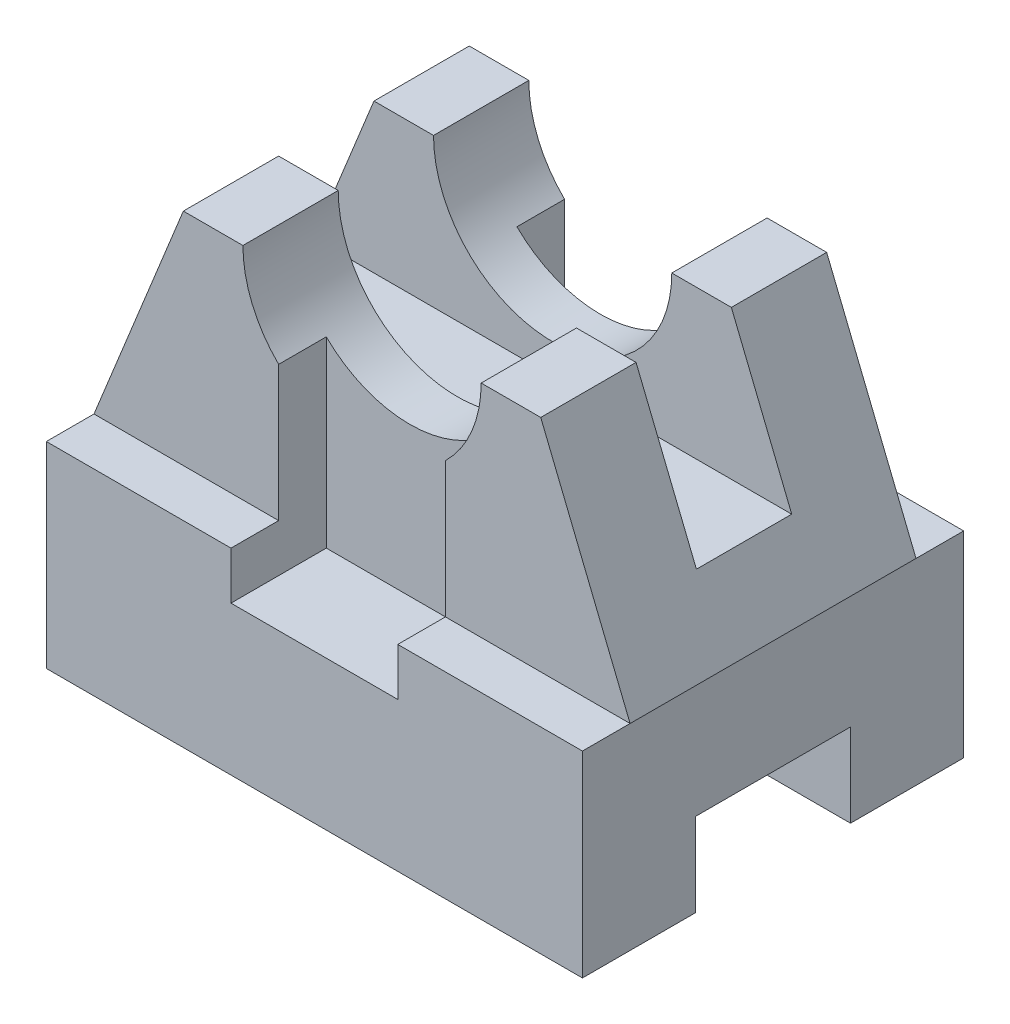
from build123d import *

# Parameters (mm, degrees)
SKETCH1_W                = 90
SKETCH1_H                = 64
BOSS_EXTRUDE1_DEPTH      = 33
BOSS_EXTRUDE2_DEPTH      = 24
BOSS_EXTRUDE2_DEPTH_BACK = 24
SKETCH3_W                = 90
SKETCH3_H                = 16
CUT_EXTRUDE1_DEPTH       = 25
SKETCH4_W                = 28
SKETCH4_H                = 16
CUT_EXTRUDE2_DEPTH       = 45
SKETCH6_W                = 90
SKETCH6_H                = 26
CUT_EXTRUDE3_DEPTH       = 14


with BuildPart() as part:
    # Sketch1 → Boss-Extrude1 (new body)
    with BuildSketch(Plane(origin=(0, 0, 0), x_dir=(1, 0, 0), z_dir=(0, 1, 0))):
        Rectangle(SKETCH1_W, SKETCH1_H)
    extrude(amount=BOSS_EXTRUDE1_DEPTH)

    # Sketch2 → Boss-Extrude2 (add, two sides: drawn at the far end of the back side and taken through both)
    with BuildSketch(Plane.XY.offset(-BOSS_EXTRUDE2_DEPTH_BACK)):
        with BuildLine():
            Line((45, 33), (-45, 33))
            Line((-45, 33), (-30, 70))
            Line((-30, 70), (-20, 70))
            ThreePointArc((-20, 70), (0, 50), (20, 70))
            Line((20, 70), (30, 70))
            Line((30, 70), (45, 33))
        make_face()
    extrude(amount=BOSS_EXTRUDE2_DEPTH + BOSS_EXTRUDE2_DEPTH_BACK)

    # Sketch3 → Cut-Extrude1 (cut)
    with BuildSketch(Plane(origin=(0, 70, 0), x_dir=(1, 0, 0), z_dir=(0, 1, 0))):
        Rectangle(SKETCH3_W, SKETCH3_H)
    extrude(amount=-CUT_EXTRUDE1_DEPTH, mode=Mode.SUBTRACT)

    # Sketch4 → Cut-Extrude2 (cut)
    with BuildSketch(Plane(origin=(0, 70, 0), x_dir=(1, 0, 0), z_dir=(0, 1, 0))):
        with Locations((0, 24)):
            Rectangle(SKETCH4_W, SKETCH4_H)
    cut_extrude2 = extrude(amount=-CUT_EXTRUDE2_DEPTH, mode=Mode.SUBTRACT)

    # Mirror1: Cut-Extrude2 across plane
    add(cut_extrude2.mirror(Plane.XY), mode=Mode.SUBTRACT)

    # Sketch6 → Cut-Extrude3 (cut)
    with BuildSketch(Plane.XZ):
        Rectangle(SKETCH6_W, SKETCH6_H)
    extrude(amount=-CUT_EXTRUDE3_DEPTH, mode=Mode.SUBTRACT)


solid = part.part
